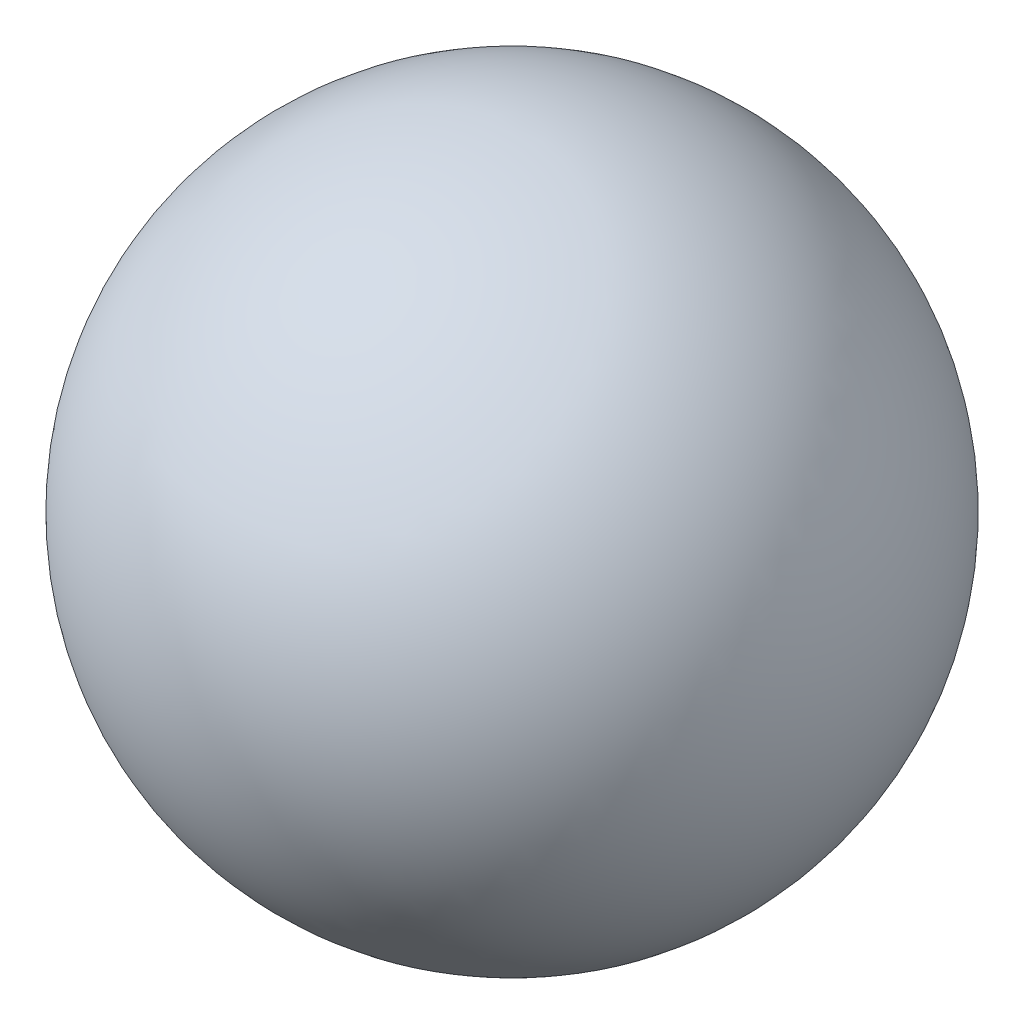
from build123d import *


with BuildPart() as part:
    # Szkic1 → Obrót1 (revolve)
    with BuildSketch(Plane.XY):
        with BuildLine():
            Line((0, 1.6), (0, -1.6))
            ThreePointArc((0, -1.6), (1.6, 0), (0, 1.6))
        make_face()
    revolve(axis=Axis((0, 1.6, 0), (0, -1, 0)))


solid = part.part
